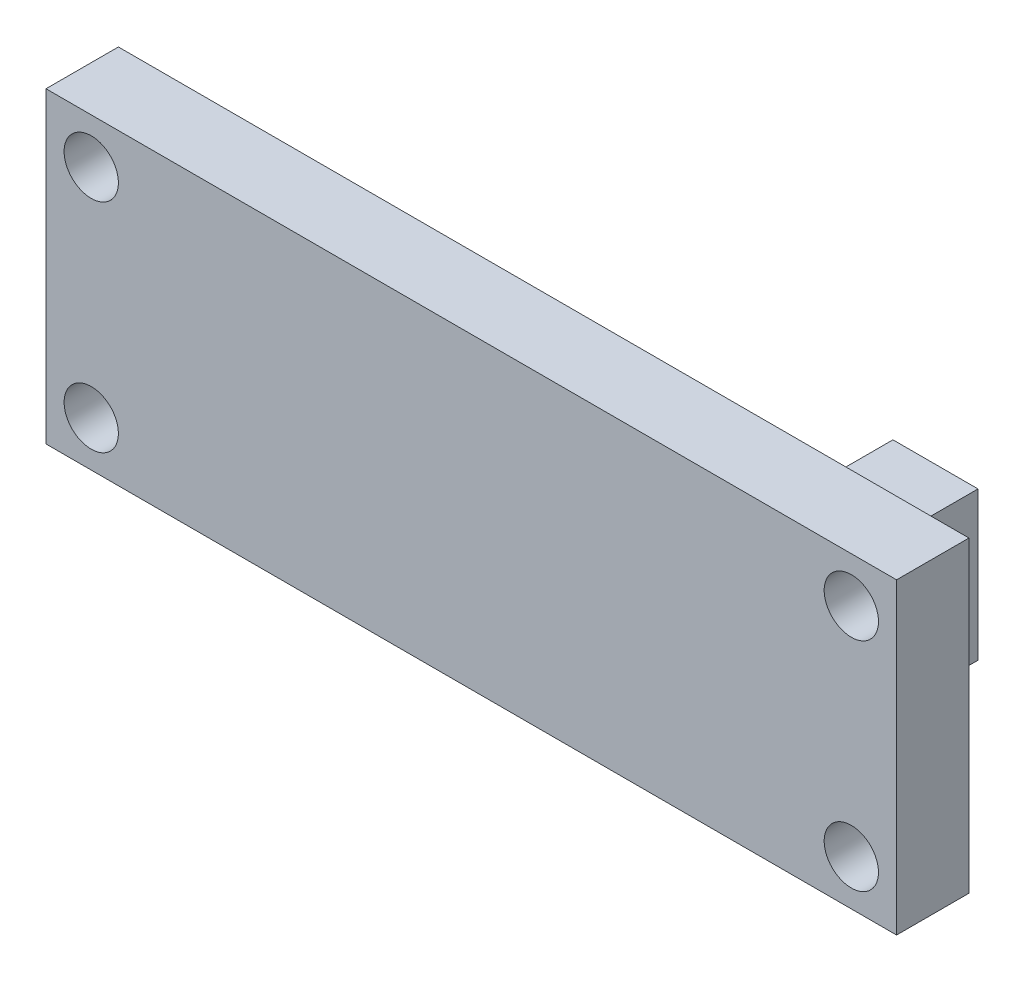
from build123d import *

# Parameters (mm, degrees)
CROQUIS1_W              = 47
CROQUIS1_H              = 17
SALIENTE_EXTRUIR1_DEPTH = 4
CROQUIS2_R              = 1.5
CORTAR_EXTRUIR1_DEPTH   = 51.139804547
CROQUIS3_W              = 4.7
CROQUIS3_H              = 8.2
SALIENTE_EXTRUIR2_DEPTH = 7


with BuildPart() as part:
    # Croquis1 → Saliente-Extruir1 (new body)
    with BuildSketch(Plane.XY):
        with Locations((-23.5, 8.5)):
            Rectangle(CROQUIS1_W, CROQUIS1_H)
    extrude(amount=SALIENTE_EXTRUIR1_DEPTH)

    # Croquis2 → Cortar-Extruir1 (cut, through all)
    with BuildSketch(Plane.XY.offset(4)):
        with Locations((-2.5, 14.5)):
            Circle(CROQUIS2_R)
        with Locations((-2.5, 2.5)):
            Circle(CROQUIS2_R)
        with Locations((-44.5, 14.5)):
            Circle(CROQUIS2_R)
        with Locations((-44.5, 2.5)):
            Circle(CROQUIS2_R)
    extrude(amount=-CORTAR_EXTRUIR1_DEPTH, mode=Mode.SUBTRACT)

    # Croquis3 → Saliente-Extruir2 (add)
    with BuildSketch(Plane(origin=(0, 0, 0), x_dir=(-1, 0, 0), z_dir=(0, 0, -1))):
        with Locations((8.85, 8.5)):
            Rectangle(CROQUIS3_W, CROQUIS3_H)
    extrude(amount=SALIENTE_EXTRUIR2_DEPTH)


solid = part.part
